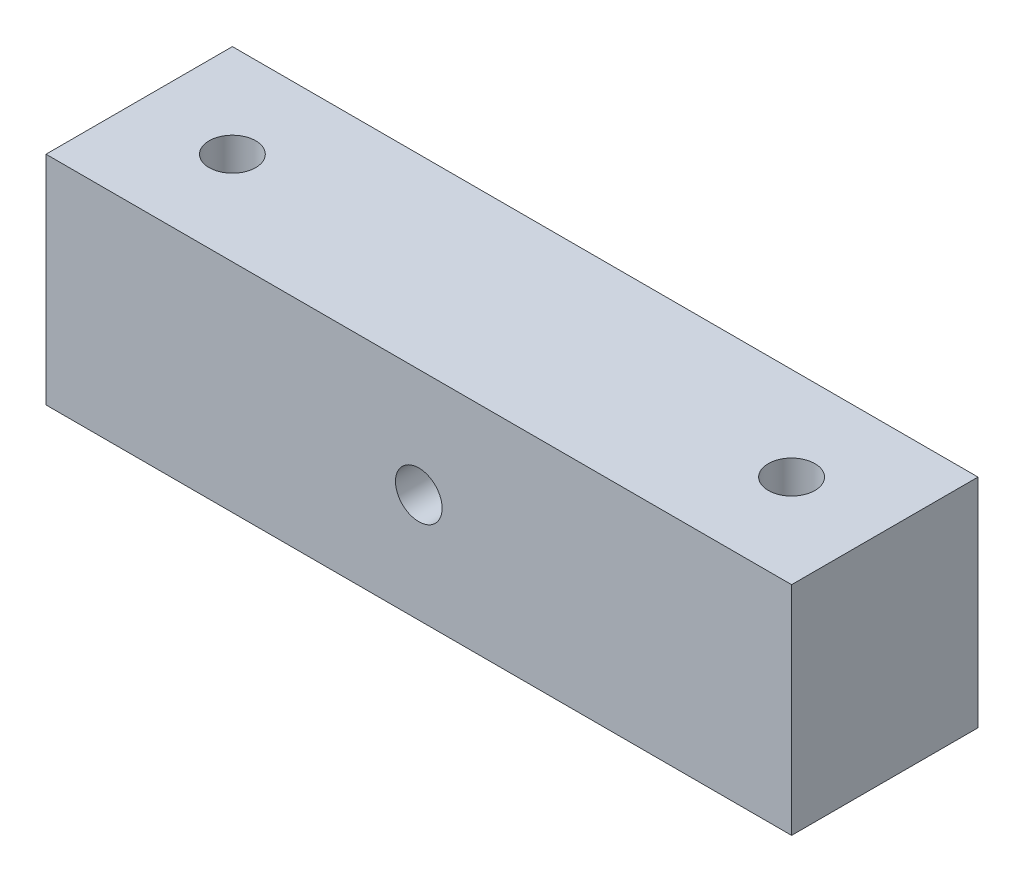
from build123d import *

# Parameters (mm, degrees)
SKETCH1_W             = 40
SKETCH1_H             = 10
BOSS_EXTRUDE1_DEPTH   = 11.65
M3X0_5_TAPPED_HOLE3_D = 2.5
M3X0_5_TAPPED_HOLE4_D = 2.5


with BuildPart() as part:
    # Sketch1 → Boss-Extrude1 (new body)
    with BuildSketch(Plane(origin=(0, 0, 0), x_dir=(1, 0, 0), z_dir=(0, 1, 0))):
        with Locations((20, 5)):
            Rectangle(SKETCH1_W, SKETCH1_H)
    extrude(amount=BOSS_EXTRUDE1_DEPTH)

    # M3x0.5 Tapped Hole3 (through all)
    with Locations(Plane(origin=(5, 11.65, -5), x_dir=(0, 0, 1), z_dir=(0, 1, 0))):
        with Locations((0, 0), (0, 30)):
            Hole(M3X0_5_TAPPED_HOLE3_D / 2)

    # M3x0.5 Tapped Hole4 (through all)
    with Locations(Plane(origin=(20, 5.825, -10), x_dir=(-1, 0, 0), z_dir=(0, 0, -1))):
        with Locations((0, 0)):
            Hole(M3X0_5_TAPPED_HOLE4_D / 2)


solid = part.part
